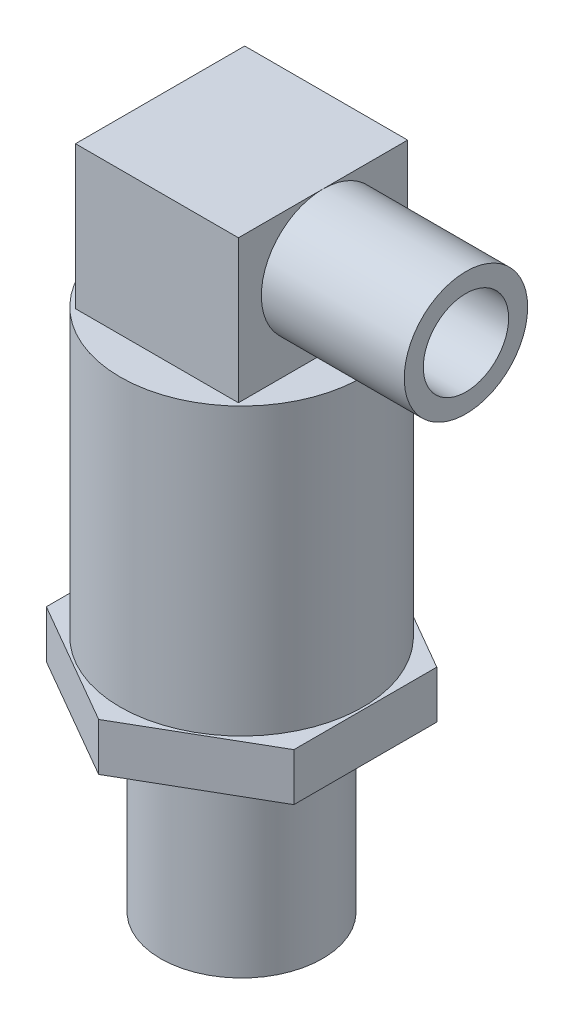
from build123d import *

# Parameters (mm, degrees)
SKETCH1_R           = 8.5
BOSS_EXTRUDE1_DEPTH = 20
BOSS_EXTRUDE2_DEPTH = 5
SKETCH3_R           = 12.74933558
BOSS_EXTRUDE3_DEPTH = 30
SKETCH4_W           = 17.102448084
SKETCH4_H           = 17.762774264
BOSS_EXTRUDE4_DEPTH = 15
SKETCH5_R           = 6.477355188
SKETCH5_R_2         = 4.477355188
EXTRUDE_THIN1_DEPTH = 15


with BuildPart() as part:
    # Sketch1 → Boss-Extrude1 (new body)
    with BuildSketch(Plane(origin=(0, 0, 0), x_dir=(1, 0, 0), z_dir=(0, 1, 0))):
        with Locations(Location((0, 0, 0), (0, 0, 270))):
            Circle(SKETCH1_R)
    extrude(amount=-BOSS_EXTRUDE1_DEPTH)

    # Sketch2 → Boss-Extrude2 (add)
    with BuildSketch(Plane(origin=(0, 0, 0), x_dir=(1, 0, 0), z_dir=(0, 1, 0))):
        Polygon((0, 15), (-12.990381057, 7.5), (-12.990381057, -7.5), (0, -15), (12.990381057, -7.5), (12.990381057, 7.5), align=None)
    extrude(amount=BOSS_EXTRUDE2_DEPTH)

    # Sketch3 → Boss-Extrude3 (add)
    with BuildSketch(Plane(origin=(0, 5, 0), x_dir=(1, 0, 0), z_dir=(0, 1, 0))):
        with Locations(Location((0, 0, 0), (0, 0, 270))):
            Circle(SKETCH3_R)
    extrude(amount=BOSS_EXTRUDE3_DEPTH)

    # Sketch4 → Boss-Extrude4 (add)
    with BuildSketch(Plane(origin=(0, 35, 0), x_dir=(1, 0, 0), z_dir=(0, 1, 0))):
        Rectangle(SKETCH4_W, SKETCH4_H)
    extrude(amount=BOSS_EXTRUDE4_DEPTH)

    # Sketch5 → Extrude-Thin1 (add)
    with BuildSketch(Plane(origin=(8.551224042, 0, 0), x_dir=(0, 0, -1), z_dir=(1, 0, 0))):
        with Locations((0, 43.522644812)):
            Circle(SKETCH5_R)
        with Locations((0, 43.522644812)):
            Circle(SKETCH5_R_2, mode=Mode.SUBTRACT)
    extrude(amount=EXTRUDE_THIN1_DEPTH)


solid = part.part
